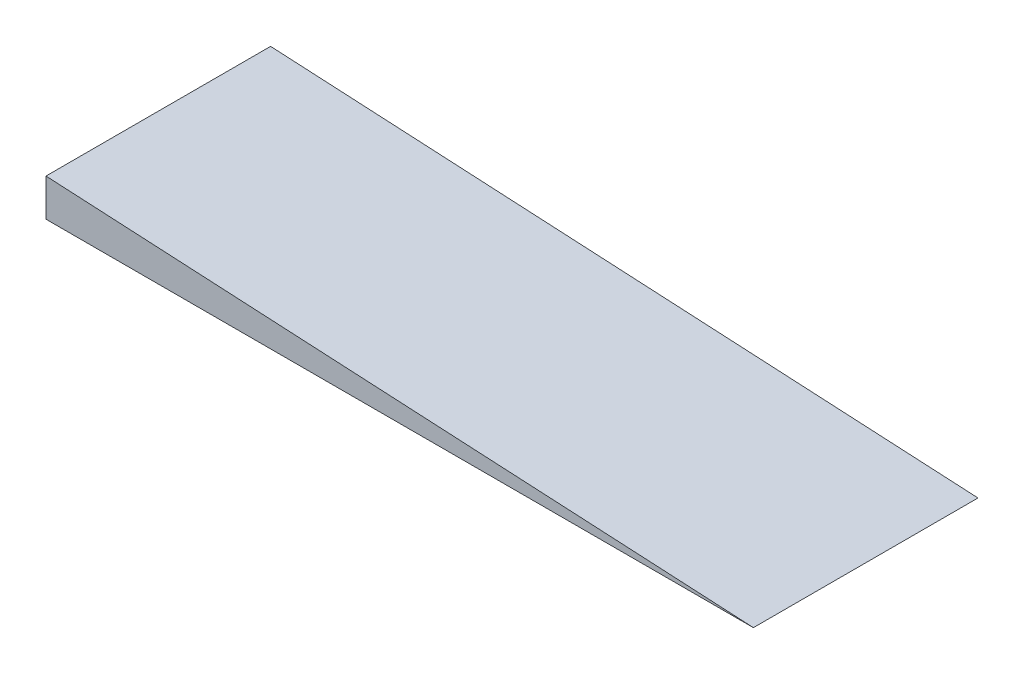
from build123d import *

# Parameters (mm, degrees)
BOSS_EXTRUDE1_DEPTH = 19.05


with BuildPart() as part:
    # Sketch1 → Boss-Extrude1 (new body)
    with BuildSketch(Plane.XY):
        Polygon((0, 0), (60, 0), (0, 3.175), align=None)
    extrude(amount=BOSS_EXTRUDE1_DEPTH)


solid = part.part
